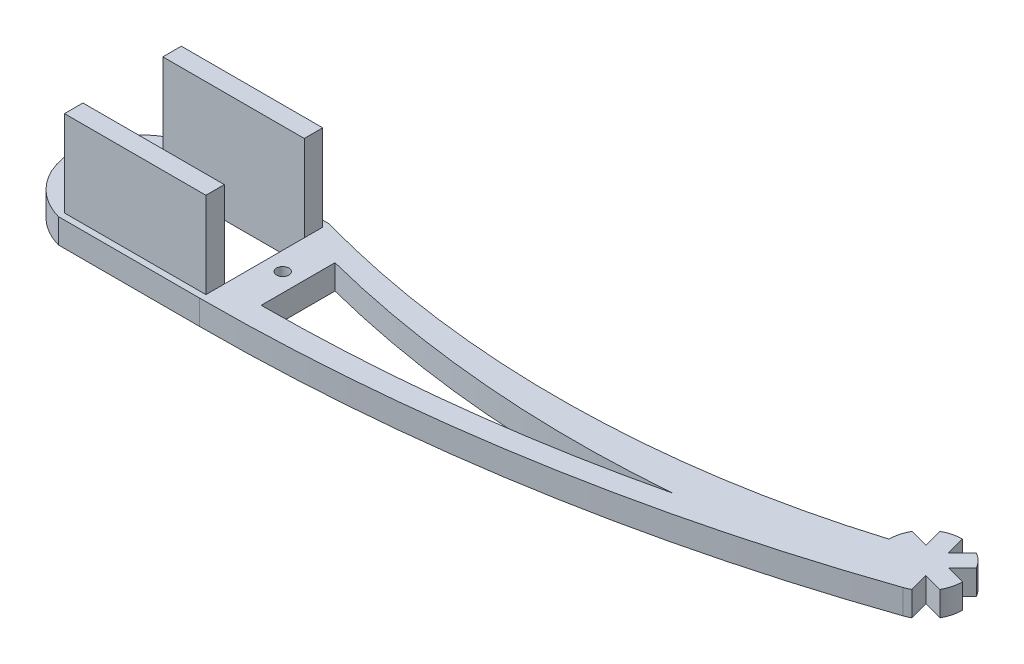
from build123d import *

# Parameters (mm, degrees)
SKETCH1_R           = 1
BOSS_EXTRUDE1_DEPTH = 4
SKETCH2_W           = 23
SKETCH2_H           = 3
BOSS_EXTRUDE2_DEPTH = 14
CUT_EXTRUDE1_DEPTH  = 116.708871167


with BuildPart() as part:
    # Sketch1 → Boss-Extrude1 (new body)
    with BuildSketch(Plane(origin=(0, 0, 0), x_dir=(1, 0, 0), z_dir=(0, 1, 0))):
        with BuildLine():
            ThreePointArc((-11.5, 10.5), (-19.5, 0), (-11.5, -10.5))
            Line((-11.5, -10.5), (11.5, -10.5))
            ThreePointArc((11.5, -10.5), (61.164895038, -6.360437032), (109.459183673, 5.944011994))
            ThreePointArc((109.459183673, 5.944011994), (110.981730745, 16.501597862), (101.5, 11.615131754))
            ThreePointArc((101.5, 11.615131754), (56.580029181, 4.598574614), (11.5, 10.5))
            Line((11.5, 10.5), (-11.5, 10.5))
        make_face()
        with Locations(Location((-14.5, 0, 0), (0, 0, 270))):
            Circle(SKETCH1_R, mode=Mode.SUBTRACT)
        Polygon((11.5, -6.5), (-11.5, -6.5), (-11.5, -3), (-12.5, -3), (-12.5, 3), (-11.5, 3), (-11.5, 6.5), (11.5, 6.5), align=None, mode=Mode.SUBTRACT)
        with Locations(Location((14.5, 0, 0), (0, 0, 270))):
            Circle(SKETCH1_R, mode=Mode.SUBTRACT)
        with BuildLine():
            Line((17.5, -6.5), (17.5, 5.5))
            ThreePointArc((17.5, 5.5), (47.290216061, 0.482498836), (77.5, 0.517787187))
            ThreePointArc((77.5, 0.517787187), (47.704508509, -4.739593528), (17.5, -6.5))
        make_face(mode=Mode.SUBTRACT)
    extrude(amount=BOSS_EXTRUDE1_DEPTH)

    # Sketch2 → Boss-Extrude2 (add)
    with BuildSketch(Plane(origin=(0, 4, 0), x_dir=(1, 0, 0), z_dir=(0, 1, 0))):
        with Locations((0, -8)):
            Rectangle(SKETCH2_W, SKETCH2_H)
        with Locations((0, 8)):
            Rectangle(SKETCH2_W, SKETCH2_H)
    extrude(amount=BOSS_EXTRUDE2_DEPTH)

    # Sketch3 → Cut-Extrude1 (cut, through all)
    with BuildSketch(Plane(origin=(0, 4, 0), x_dir=(1, 0, 0), z_dir=(0, 1, 0))):
        with BuildLine():
            Line((102.276706609, 14.567623271), (105.378679656, 13.736452098))
            Line((105.378679656, 13.736452098), (104.547508484, 16.838425145))
            ThreePointArc((104.547508484, 16.838425145), (103.257359313, 15.857772441), (102.276706609, 14.567623271))
        make_face()
        with BuildLine():
            ThreePointArc((110.54725901, 16.783711107), (109.052914271, 17.410686712), (107.445285962, 17.61488228))
            Line((107.445285962, 17.61488228), (108.276457135, 14.512909233))
            Line((108.276457135, 14.512909233), (110.54725901, 16.783711107))
        make_face()
        with BuildLine():
            ThreePointArc((113.499750526, 11.560417717), (113.295554958, 13.168046025), (112.668579353, 14.662390764))
            Line((112.668579353, 14.662390764), (110.397777479, 12.391588889))
            Line((110.397777479, 12.391588889), (113.499750526, 11.560417717))
        make_face()
        with BuildLine():
            ThreePointArc((110.452491516, 6.391838363), (111.742640687, 7.372491067), (112.723293391, 8.662640238))
            Line((112.723293391, 8.662640238), (109.621320344, 9.493811411))
            Line((109.621320344, 9.493811411), (110.452491516, 6.391838363))
        make_face()
    extrude(amount=-CUT_EXTRUDE1_DEPTH, mode=Mode.SUBTRACT)


solid = part.part
